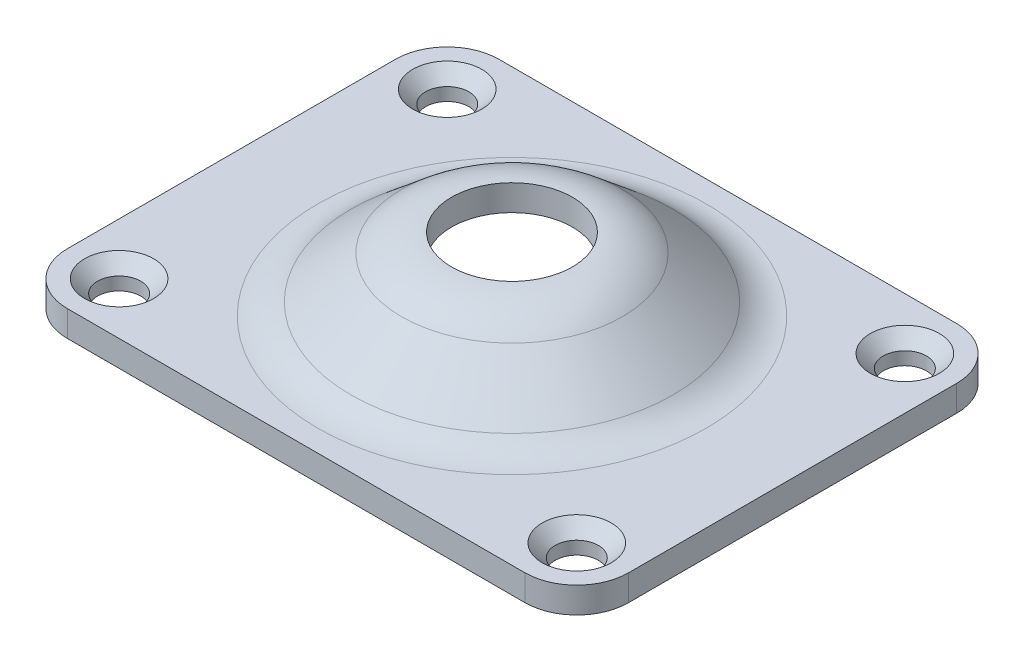
from build123d import *

# Parameters (mm, degrees)
SKETCH1_R           = 2.5
SKETCH1_R_2         = 22.5
BOSS_EXTRUDE1_DEPTH = 3
CHAMFER1_SIZE       = 1.5


with BuildPart() as part:
    # Sketch1 → Boss-Extrude1 (new body)
    with BuildSketch(Plane(origin=(0, 0, 0), x_dir=(0, 0, -1), z_dir=(0, 1, 0))):
        with BuildLine():
            Line((19, 32.5), (-19, 32.5))
            ThreePointArc((-19, 32.5), (-23.242640687, 30.742640687), (-25, 26.5))
            Line((-25, 26.5), (-25, -26.5))
            ThreePointArc((-25, -26.5), (-23.242640687, -30.742640687), (-19, -32.5))
            Line((-19, -32.5), (19, -32.5))
            ThreePointArc((19, -32.5), (23.242640687, -30.742640687), (25, -26.5))
            Line((25, -26.5), (25, 26.5))
            ThreePointArc((25, 26.5), (23.242640687, 30.742640687), (19, 32.5))
        make_face()
        with Locations(Location((-19, 26.5, 0), (0, 0, 180))):
            Circle(SKETCH1_R, mode=Mode.SUBTRACT)
        with Locations(Location((19, 26.5, 0), (0, 0, 180))):
            Circle(SKETCH1_R, mode=Mode.SUBTRACT)
        with Locations(Location((19, -26.5, 0), (0, 0, 180))):
            Circle(SKETCH1_R, mode=Mode.SUBTRACT)
        with Locations(Location((-19, -26.5, 0), (0, 0, 180))):
            Circle(SKETCH1_R, mode=Mode.SUBTRACT)
        with Locations(Location((0, 0, 0), (0, 0, 180))):
            Circle(SKETCH1_R_2, mode=Mode.SUBTRACT)
    extrude(amount=BOSS_EXTRUDE1_DEPTH)

    # Sketch2 → Revolve1 (revolve)
    with BuildSketch(Plane(origin=(0, 0, 0), x_dir=(0, 1, 0), z_dir=(-1, 0, 0)), mode=Mode.PRIVATE) as revolve1_sk:
        with BuildLine():
            Line((4.403733341, 18.643274342), (9.319334931, 12.785088487))
            ThreePointArc((9.319334931, 12.785088487), (10.88216853, 10.07818129), (11.424934943, 7))
            Line((11.424934943, 7), (8.424934943, 7))
            ThreePointArc((8.424934943, 7), (8.063090668, 9.05212086), (7.021201602, 10.856725658))
            Line((7.021201602, 10.856725658), (2.105600012, 16.714911513))
            ThreePointArc((2.105600012, 16.714911513), (0.542766413, 19.42181871), (0, 22.5))
            Line((0, 22.5), (3, 22.5))
            ThreePointArc((3, 22.5), (3.361844275, 20.44787914), (4.403733341, 18.643274342))
        make_face()
    revolve(revolve1_sk.sketch.rotate(Axis((0, 0, 0), (0, -1, 0)), 180), axis=Axis((0, 0, 0), (0, -1, 0)))

    # Chamfer1
    chamfer1_edges = [part.edges().sort_by_distance(p)[0] for p in [
        (-26.5, 3, -21.5),
        (-26.5, 3, 16.5),
        (26.5, 3, -21.5),
        (26.5, 3, 16.5),
    ]]
    chamfer(chamfer1_edges, length=CHAMFER1_SIZE)


solid = part.part
